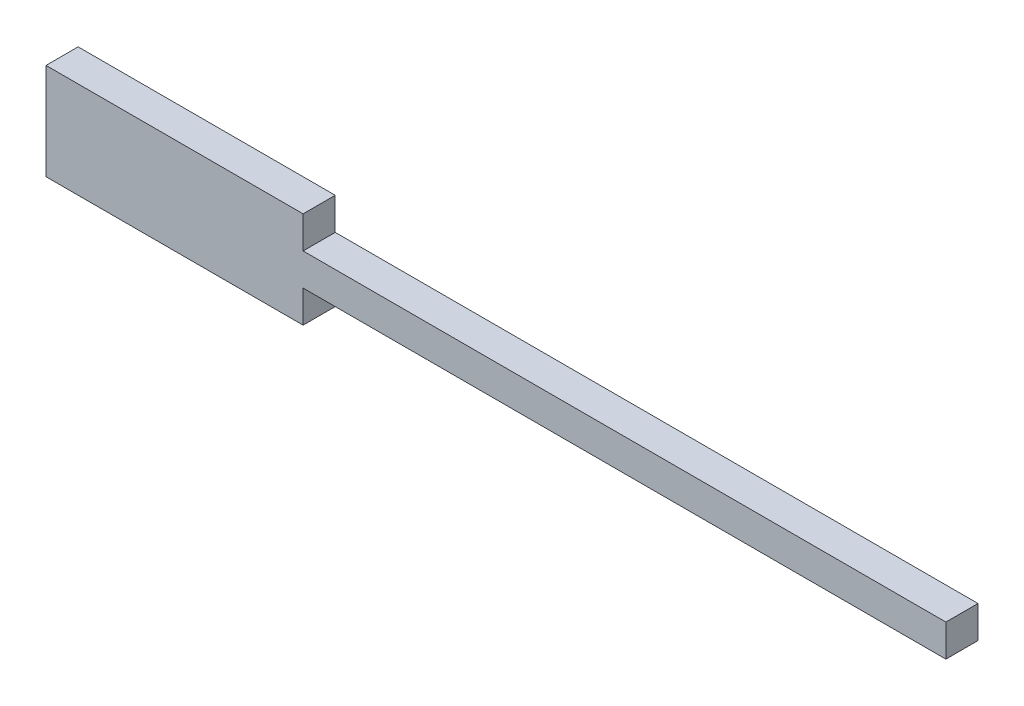
from build123d import *

# Parameters (mm, degrees)
BOSS_EXTRUDE1_DEPTH = 5


with BuildPart() as part:
    # Sketch1 → Boss-Extrude1 (new body)
    with BuildSketch(Plane.XY):
        Polygon((-54.093453064, 0), (-14.093453064, 0), (-14.093453064, 5), (85.906546936, 5), (85.906546936, 10), (-14.093453064, 10), (-14.093453064, 15), (-54.093453064, 15), align=None)
    extrude(amount=BOSS_EXTRUDE1_DEPTH)


solid = part.part
